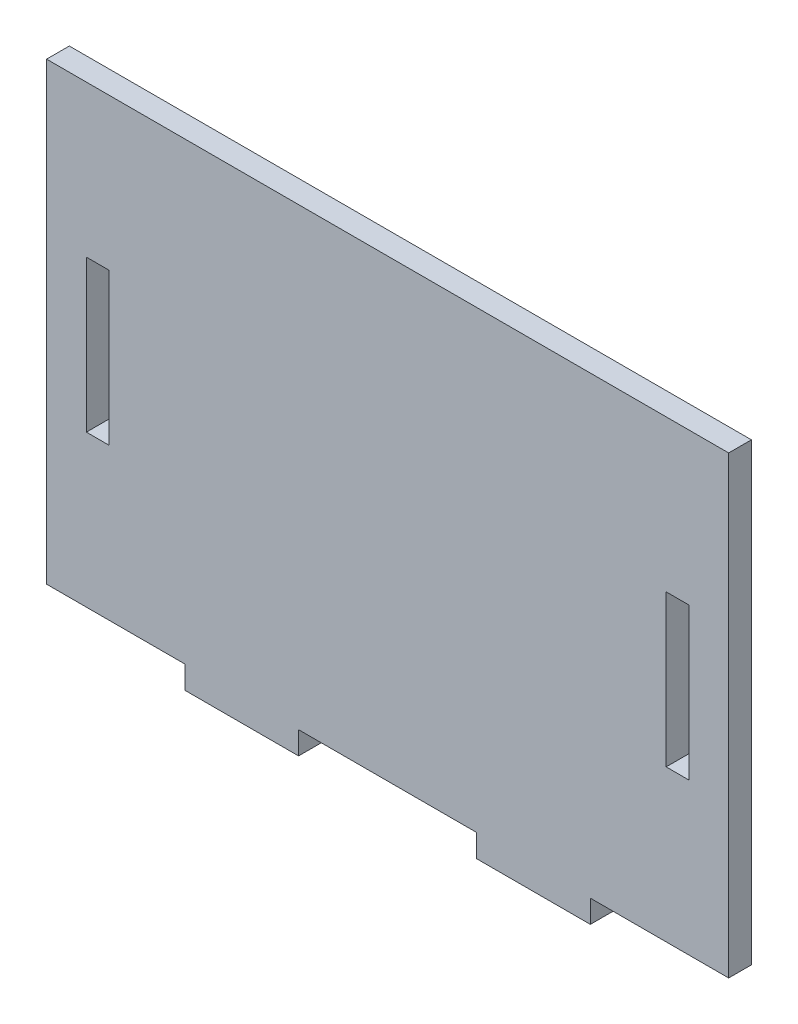
from build123d import *

# Parameters (mm, degrees)
SKETCH_1_W      = 90
SKETCH_1_H      = 60
SKETCH_1_W_2    = 3
SKETCH_1_H_2    = 20
SKETCH_1_W_3    = 15
SKETCH_1_H_3    = 3
EXTRUDE_1_DEPTH = 3


with BuildPart() as part:
    # 草图1 → 凸台-拉伸1 (new body)
    # profile 1 of 3: a face of its own
    with BuildSketch(Plane.XY):
        with Locations((45, 30)):
            Rectangle(SKETCH_1_W, SKETCH_1_H)
        with Locations((83.25, 30)):
            Rectangle(SKETCH_1_W_2, SKETCH_1_H_2, mode=Mode.SUBTRACT)
        with Locations((6.75, 30)):
            Rectangle(SKETCH_1_W_2, SKETCH_1_H_2, mode=Mode.SUBTRACT)
    # profile 2 of 3: a face of its own
    with BuildSketch(Plane.XY):
        with Locations((25.75, -1.5)):
            Rectangle(SKETCH_1_W_3, SKETCH_1_H_3)
    # profile 3 of 3: a face of its own
    with BuildSketch(Plane.XY):
        with Locations((64.25, -1.5)):
            Rectangle(SKETCH_1_W_3, SKETCH_1_H_3)
    extrude(amount=EXTRUDE_1_DEPTH)


solid = part.part
